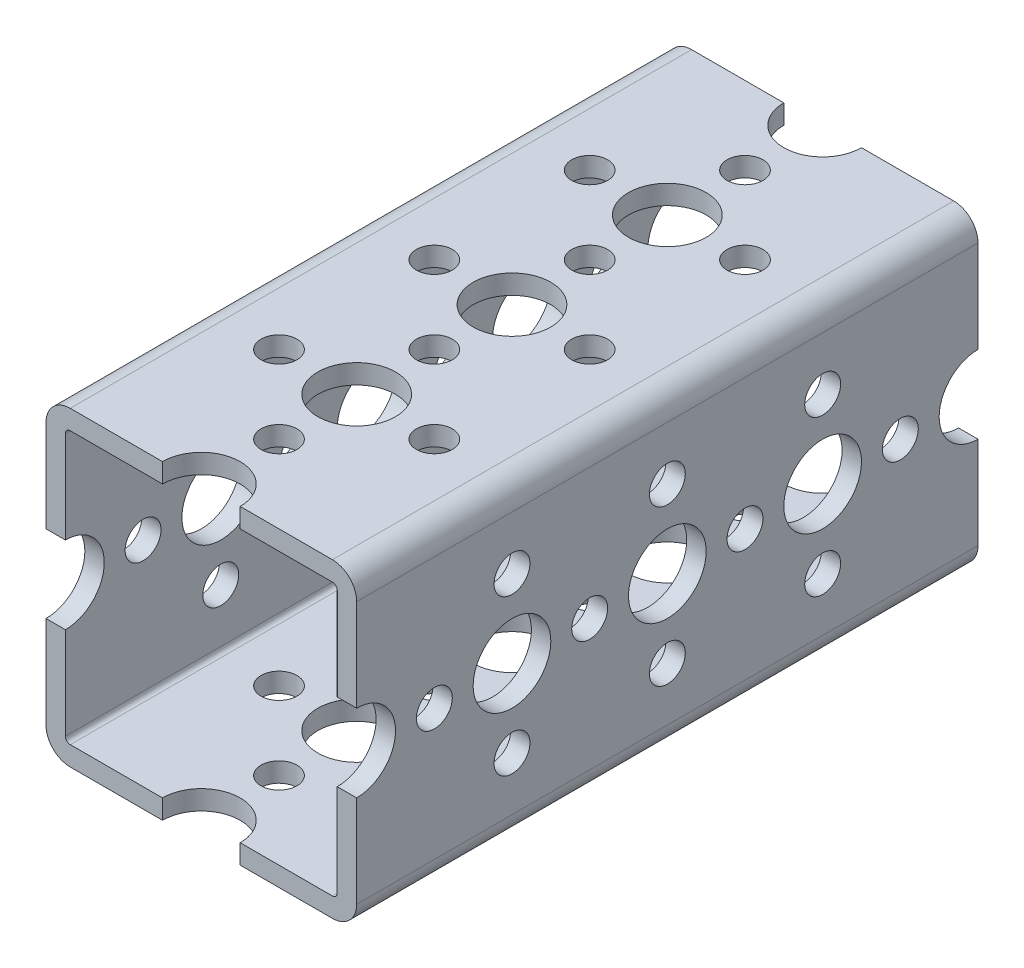
from build123d import *

# Parameters (mm, degrees)
BOSS_EXTRUDE1_DEPTH = 32
SKETCH2_R           = 4
SKETCH2_R_2         = 1.85
CUT_EXTRUDE1_DEPTH  = 49
CIRPATTERN1_COUNT   = 2
CIRPATTERN1_ANGLE   = 90


with BuildPart() as part:
    # Sketch1 → Boss-Extrude1 (new, symmetric)
    with BuildSketch(Plane.XY):
        with BuildLine():
            Line((-13.5, 16), (13.5, 16))
            ThreePointArc((13.5, 16), (15.267766953, 15.267766953), (16, 13.5))
            Line((16, 13.5), (16, -13.5))
            ThreePointArc((16, -13.5), (15.267766953, -15.267766953), (13.5, -16))
            Line((13.5, -16), (-13.5, -16))
            ThreePointArc((-13.5, -16), (-15.267766953, -15.267766953), (-16, -13.5))
            Line((-16, -13.5), (-16, 13.5))
            ThreePointArc((-16, 13.5), (-15.267766953, 15.267766953), (-13.5, 16))
        make_face()
        with BuildLine():
            Line((-13.5, 14), (13.5, 14))
            ThreePointArc((13.5, 14), (13.853553391, 13.853553391), (14, 13.5))
            Line((14, 13.5), (14, -13.5))
            ThreePointArc((14, -13.5), (13.853553391, -13.853553391), (13.5, -14))
            Line((13.5, -14), (-13.5, -14))
            ThreePointArc((-13.5, -14), (-13.853553391, -13.853553391), (-14, -13.5))
            Line((-14, -13.5), (-14, 13.5))
            ThreePointArc((-14, 13.5), (-13.853553391, 13.853553391), (-13.5, 14))
        make_face(mode=Mode.SUBTRACT)
    extrude(amount=BOSS_EXTRUDE1_DEPTH, both=True)

    # Sketch2 → Cut-Extrude1 (cut, through all)
    with BuildSketch(Plane(origin=(16, 0, 0), x_dir=(0, 0, -1), z_dir=(1, 0, 0))):
        Circle(SKETCH2_R)
        with Locations((16, 0)):
            Circle(SKETCH2_R)
        with Locations((32, 0)):
            Circle(SKETCH2_R)
        with Locations((-16, 0)):
            Circle(SKETCH2_R)
        with Locations((-32, 0)):
            Circle(SKETCH2_R)
        with Locations((24, 0)):
            Circle(SKETCH2_R_2)
        with Locations((16, 8)):
            Circle(SKETCH2_R_2)
        with Locations((16, -8)):
            Circle(SKETCH2_R_2)
        with Locations((8, 0)):
            Circle(SKETCH2_R_2)
        with Locations((-8, 0)):
            Circle(SKETCH2_R_2)
        with Locations((-24, 0)):
            Circle(SKETCH2_R_2)
        with Locations((-16, -8)):
            Circle(SKETCH2_R_2)
        with Locations((-16, 8)):
            Circle(SKETCH2_R_2)
        with Locations((0, 8)):
            Circle(SKETCH2_R_2)
        with Locations((0, -8)):
            Circle(SKETCH2_R_2)
    cut_extrude1 = extrude(amount=-CUT_EXTRUDE1_DEPTH, mode=Mode.SUBTRACT)

    # CirPattern1: Cut-Extrude1 ×2 about axis
    cirpattern1_axis = Axis((0, 0, -17.6), (0, 0, 1))
    for i in range(1, CIRPATTERN1_COUNT):
        add(cut_extrude1.rotate(cirpattern1_axis, i * CIRPATTERN1_ANGLE / (CIRPATTERN1_COUNT - 1)), mode=Mode.SUBTRACT)


solid = part.part
